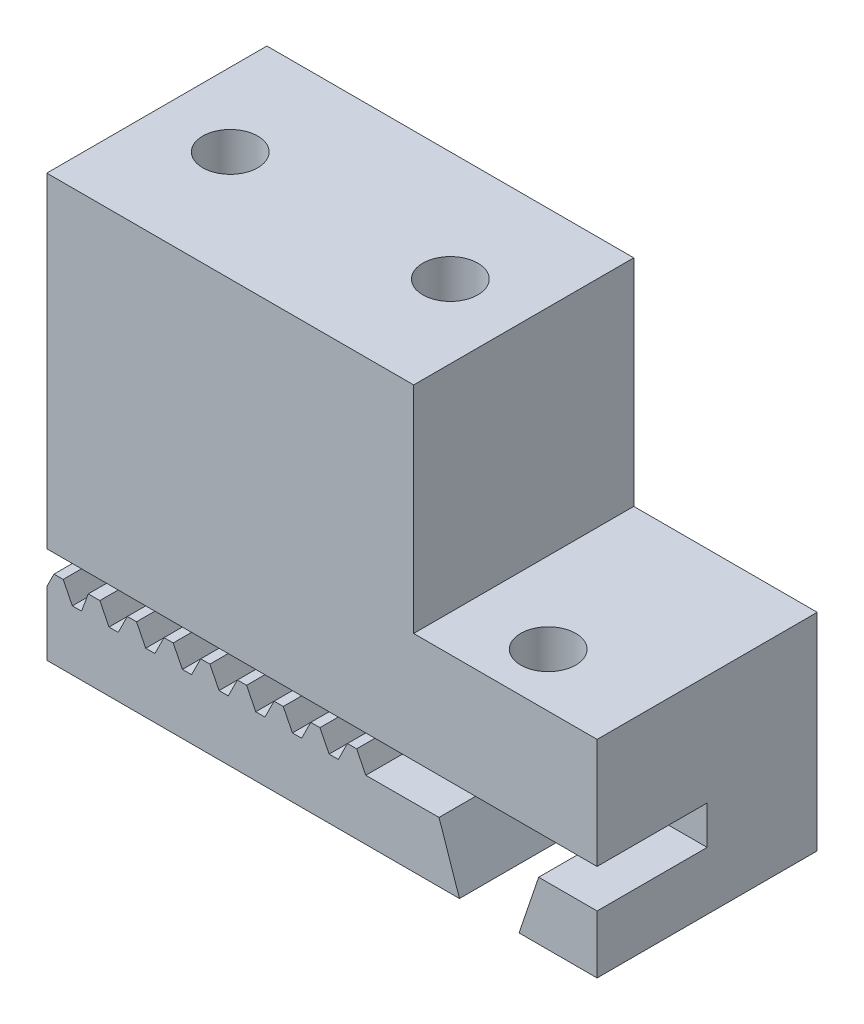
from build123d import *

# Parameters (mm, degrees)
SKETCH_2_W          = 30
SKETCH_2_H          = 23
EXTRUDE_1_DEPTH     = 12
CUT_EXTRUDE_1_DEPTH = 6
SKETCH_4_W          = 15.467270909
SKETCH_4_H          = 13.987209034
CUT_EXTRUDE_2_DEPTH = 40.66106403
SKETCH_5_R          = 1.5
CUT_EXTRUDE_3_DEPTH = 8
SKETCH_6_R          = 1.5
CUT_EXTRUDE_4_DEPTH = 12


with BuildPart() as part:
    # 草图2 → 凸台-拉伸1 (new body)
    with BuildSketch(Plane.XY):
        with Locations((15, 11.5)):
            Rectangle(SKETCH_2_W, SKETCH_2_H)
    extrude(amount=EXTRUDE_1_DEPTH)

    # 草图3 → 切除-拉伸1 (cut)
    with BuildSketch(Plane.XY.offset(12)):
        Polygon((-0.106519248, 5.265031781), (32.137743655, 5.265031781), (32.137743655, 3.165031781), (26.814729775, 3.165031781), (25.621504988, -0.36450698), (22.621504988, -0.36450698), (21.382763952, 3.273233944), (17.391329844, 3.265031781), (16.891449339, 4.265031781), (16.391449339, 4.265031781), (15.891568834, 3.265031781), (15.391568834, 3.265031781), (14.891688328, 4.265031781), (14.391688328, 4.265031781), (13.891807823, 3.265031781), (13.391807823, 3.265031781), (12.891927318, 4.265031781), (12.391927318, 4.265031781), (11.892046813, 3.265031781), (11.392046813, 3.265031781), (10.892166308, 4.265031781), (10.392166308, 4.265031781), (9.892285803, 3.265031781), (9.392285803, 3.265031781), (8.892405298, 4.265031781), (8.392405298, 4.265031781), (7.892524793, 3.265031781), (7.392524793, 3.265031781), (6.892644288, 4.265031781), (6.392644288, 4.265031781), (5.892763783, 3.265031781), (5.392763783, 3.265031781), (4.892883278, 4.265031781), (4.392883278, 4.265031781), (3.893002773, 3.265031781), (3.393002773, 3.265031781), (2.893122268, 4.265031781), (2.260638047, 4.265031781), (1.893241763, 3.265031781), (1.393241763, 3.265031781), (0.893361258, 4.265031781), (0.393361258, 4.265031781), (-0.106519248, 3.265031781), align=None)
    extrude(amount=-CUT_EXTRUDE_1_DEPTH, mode=Mode.SUBTRACT)

    # 草图4 → 切除-拉伸2 (cut, through all)
    with BuildSketch(Plane.XY.offset(12)):
        with Locations((27.733635454, 18.258636298)):
            Rectangle(SKETCH_4_W, SKETCH_4_H)
    extrude(amount=-CUT_EXTRUDE_2_DEPTH, mode=Mode.SUBTRACT)

    # 草图5 → 切除-拉伸3 (cut)
    with BuildSketch(Plane(origin=(0, 11.265031781, 0), x_dir=(1, 0, 0), z_dir=(0, 1, 0))):
        with Locations(Location((24.410160755, -9.07584536, 0), (0, 0, 270))):
            Circle(SKETCH_5_R)
    extrude(amount=-CUT_EXTRUDE_3_DEPTH, mode=Mode.SUBTRACT)

    # 草图6 → 切除-拉伸4 (cut)
    with BuildSketch(Plane(origin=(0, 23, 0), x_dir=(1, 0, 0), z_dir=(0, 1, 0))):
        with Locations(Location((4, -6, 0), (0, 0, 270))):
            Circle(SKETCH_6_R)
        with Locations(Location((16, -6, 0), (0, 0, 90))):
            Circle(SKETCH_6_R)
    extrude(amount=-CUT_EXTRUDE_4_DEPTH, mode=Mode.SUBTRACT)


solid = part.part
